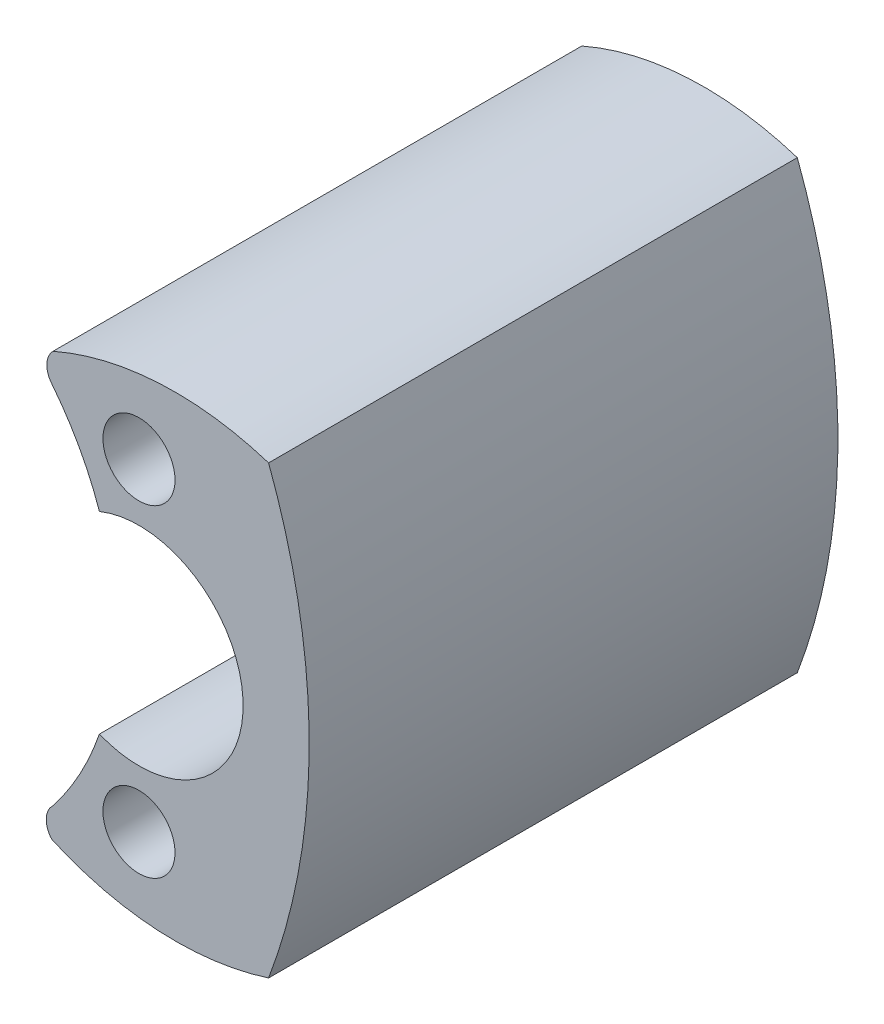
from build123d import *

# Parameters (mm, degrees)
EXTRUDE1_DEPTH      = 22
EXTRUDE1_DEPTH_BACK = 0.001
SKETCH3_R           = 1.5
CUT_EXTRUDE1_DEPTH  = 26.140806237
SKETCH5_R           = 4.335
CUT_EXTRUDE2_DEPTH  = 24


with BuildPart() as part:
    # Sketch1 → Extrude1 (new, two sides: drawn at the far end of the back side and taken through both)
    with BuildSketch(Plane.XY.offset(-EXTRUDE1_DEPTH_BACK)):
        with BuildLine():
            ThreePointArc((5.394294709, 9.281673418), (7.083207262, 0), (5.394294709, -9.281673418))
            ThreePointArc((5.394294709, -9.281673418), (0.839593343, -9.873480825), (-3.625620963, -8.797654747))
            ThreePointArc((-3.625620963, -8.797654747), (-3.857898862, -8.166383103), (-3.57576768, -7.555761366))
            ThreePointArc((-3.57576768, -7.555761366), (-0.970954643, 0.05080099), (-3.638712866, 7.635516404))
            ThreePointArc((-3.638712866, 7.635516404), (-3.831936153, 8.239573474), (-3.57576768, 8.819744049))
            ThreePointArc((-3.57576768, 8.819744049), (0.866819678, 9.874912356), (5.394294709, 9.281673418))
        make_face()
    extrude(amount=EXTRUDE1_DEPTH + EXTRUDE1_DEPTH_BACK)

    # Sketch3 → Cut-Extrude1 (cut, through all)
    with BuildSketch(Plane.XY.offset(22)):
        with Locations((0, 6.715)):
            Circle(SKETCH3_R)
        with Locations(Location((0, -6.715, 0), (0, 0, 180))):
            Circle(SKETCH3_R)
    extrude(amount=-CUT_EXTRUDE1_DEPTH, mode=Mode.SUBTRACT)

    # Sketch5 → Cut-Extrude2 (cut)
    with BuildSketch(Plane(origin=(0, 0, -0.001), x_dir=(-1, 0, 0), z_dir=(0, 0, -1))):
        Circle(SKETCH5_R)
    extrude(amount=-CUT_EXTRUDE2_DEPTH, mode=Mode.SUBTRACT)


solid = part.part
